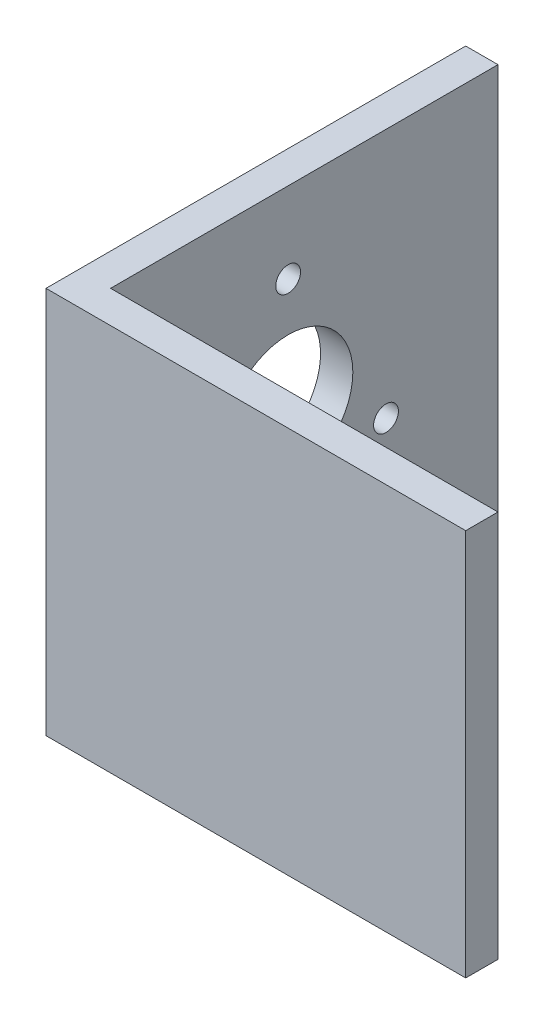
from build123d import *

# Parameters (mm, degrees)
EXTRUDE_THIN1_DEPTH   = 38.1
SKETCH2_R             = 6.3627
CUT_EXTRUDE1_DEPTH    = 68.873747686
F_2_CLEARANCE_HOLE1_D = 2.4384


with BuildPart() as part:
    # Sketch1 → Extrude-Thin1 (new body)
    with BuildSketch(Plane(origin=(0, 0, 0), x_dir=(1, 0, 0), z_dir=(0, 1, 0))):
        Polygon((0, 38.1), (0, 0), (38.1, 0), (38.1, -3.175), (-3.175, -3.175), (-3.175, 38.1), align=None)
    extrude(amount=EXTRUDE_THIN1_DEPTH)

    # Sketch2 → Cut-Extrude1 (cut, through all)
    with BuildSketch(Plane.ZY.offset(3.175)):
        with Locations((-17.4625, 19.05)):
            Circle(SKETCH2_R)
    extrude(amount=-CUT_EXTRUDE1_DEPTH, mode=Mode.SUBTRACT)

    # #2 Clearance Hole1 (through all)
    with Locations(Plane.ZY.offset(3.175)):
        with Locations((-27.0862073, 13.49375), (-17.4625, 30.1625), (-7.8387927, 13.49375)):
            Hole(F_2_CLEARANCE_HOLE1_D / 2)


solid = part.part
